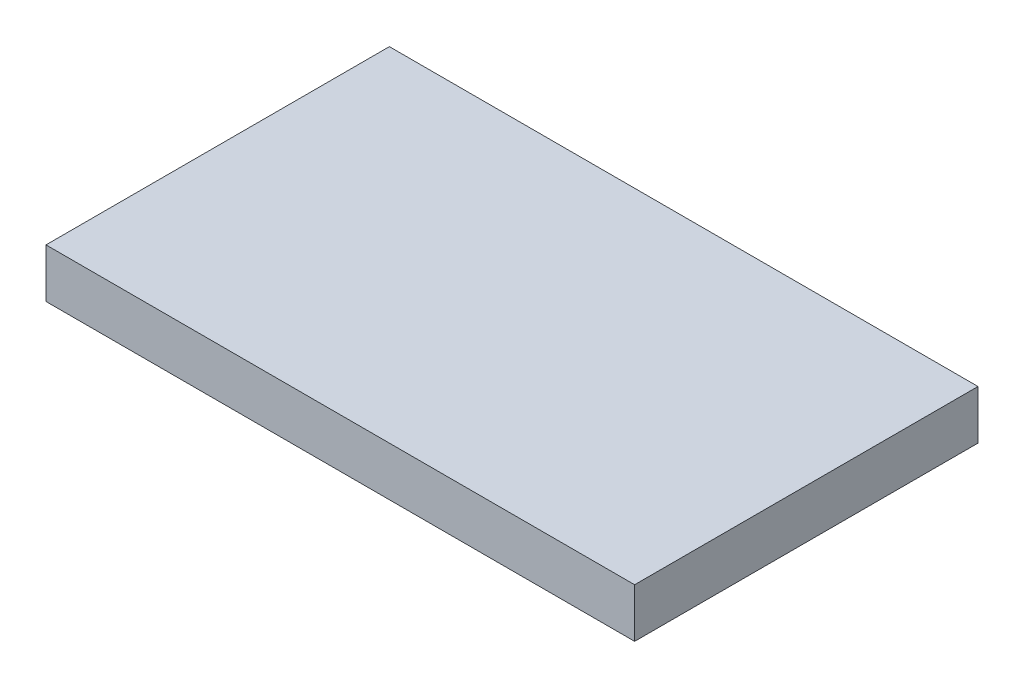
from build123d import *

# Parameters (mm, degrees)
SKETCH1_W           = 60
SKETCH1_H           = 35
BOSS_EXTRUDE1_DEPTH = 5


with BuildPart() as part:
    # Sketch1 → Boss-Extrude1 (new body)
    with BuildSketch(Plane(origin=(0, 0, 0), x_dir=(1, 0, 0), z_dir=(0, 1, 0))):
        with Locations((30, 17.5)):
            Rectangle(SKETCH1_W, SKETCH1_H)
    extrude(amount=BOSS_EXTRUDE1_DEPTH)


solid = part.part
